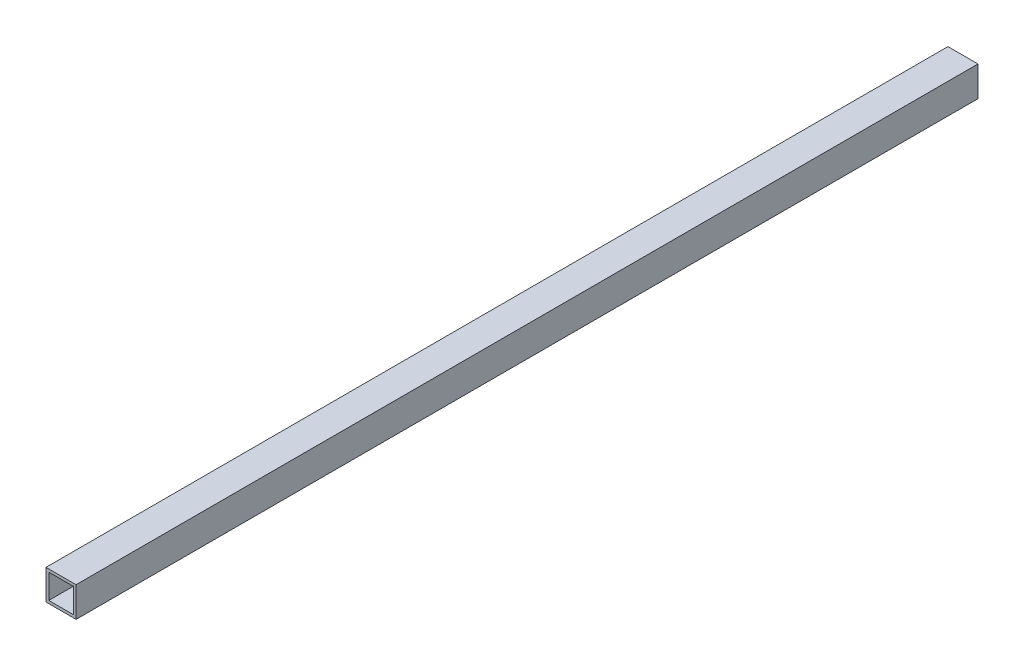
from build123d import *

# Parameters (mm, degrees)
SKETCH1_W           = 10
SKETCH1_H           = 10
SKETCH1_W_2         = 8.166870646
SKETCH1_H_2         = 8.166870646
BOSS_EXTRUDE1_DEPTH = 300


with BuildPart() as part:
    # Sketch1 → Boss-Extrude1 (new body)
    with BuildSketch(Plane.XY):
        Rectangle(SKETCH1_W, SKETCH1_H)
        Rectangle(SKETCH1_W_2, SKETCH1_H_2, mode=Mode.SUBTRACT)
    extrude(amount=BOSS_EXTRUDE1_DEPTH)


solid = part.part
